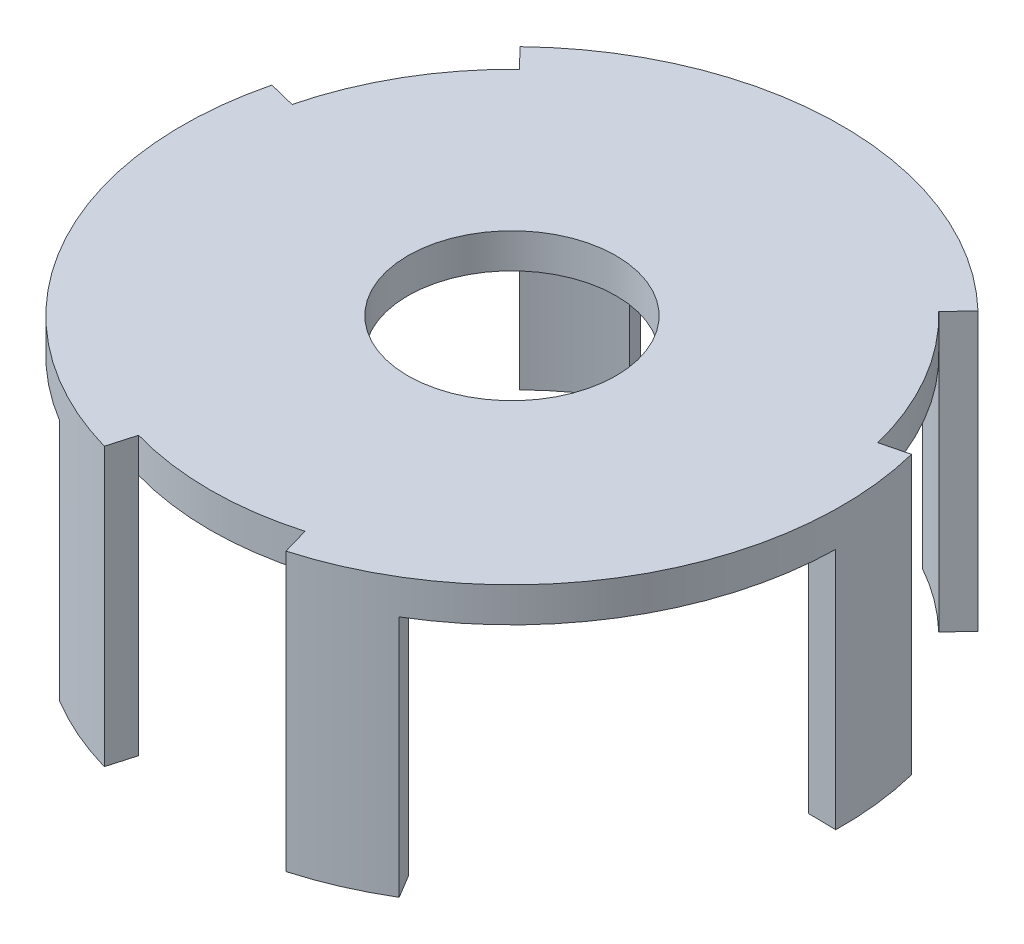
from build123d import *

# Parameters (mm, degrees)
CROQUIS2_R              = 47.5
CROQUIS2_R_2            = 15
SALIENTE_EXTRUIR1_DEPTH = 5
CORTAR_EXTRUIR1_START   = -5
CORTAR_EXTRUIR1_DEPTH   = 5
SALIENTE_EXTRUIR2_DEPTH = 35


with BuildPart() as part:
    # Croquis2 → Saliente-Extruir1 (new body)
    with BuildSketch(Plane(origin=(0, 40, 0), x_dir=(1, 0, 0), z_dir=(0, 1, 0))):
        with Locations(Location((0, 0, 0), (0, 0, 270))):
            Circle(CROQUIS2_R)
        with Locations(Location((0, 0, 0), (0, 0, 270))):
            Circle(CROQUIS2_R_2, mode=Mode.SUBTRACT)
    extrude(amount=-SALIENTE_EXTRUIR1_DEPTH)

    # Croquis3 → Cortar-Extruir1 (cut)
    with BuildSketch(Plane.XZ.offset(-35).offset(CORTAR_EXTRUIR1_START)):
        with BuildLine():
            Line((-11.990224978, 41.814883773), (-13.092774401, 45.659930557))
            ThreePointArc((-13.092774401, 45.659930557), (0, 47.5), (13.092774401, 45.659930557))
            Line((13.092774401, 45.659930557), (11.990224978, 41.814883773))
            ThreePointArc((11.990224978, 41.814883773), (0, 43.5), (-11.990224978, 41.814883773))
        make_face()
        with BuildLine():
            Line((30.217639115, -31.291281315), (32.996272597, -34.168640516))
            ThreePointArc((32.996272597, -34.168640516), (41.13620668, -23.75), (46.089046998, -11.491290041))
            Line((46.089046998, -11.491290041), (42.207864093, -10.523602459))
            ThreePointArc((42.207864093, -10.523602459), (37.672105065, -21.75), (30.217639115, -31.291281315))
        make_face()
        with BuildLine():
            Line((-42.207864093, -10.523602459), (-46.089046998, -11.491290041))
            ThreePointArc((-46.089046998, -11.491290041), (-41.13620668, -23.75), (-32.996272597, -34.168640516))
            Line((-32.996272597, -34.168640516), (-30.217639115, -31.291281315))
            ThreePointArc((-30.217639115, -31.291281315), (-37.672105065, -21.75), (-42.207864093, -10.523602459))
        make_face()
    extrude(amount=CORTAR_EXTRUIR1_DEPTH, mode=Mode.SUBTRACT)

    # Croquis4 → Saliente-Extruir2 (add)
    with BuildSketch(Plane.XZ.offset(-35)):
        with BuildLine():
            Line((-43.493374739, 0.75917968), (-47.49276552, 0.828989306))
            ThreePointArc((-47.49276552, 0.828989306), (-47.194663145, -5.377152654), (-46.089046998, -11.491290041))
            Line((-46.089046998, -11.491290041), (-42.207864093, -10.523602459))
            ThreePointArc((-42.207864093, -10.523602459), (-43.220375722, -4.924339799), (-43.493374739, 0.75917968))
        make_face()
        with BuildLine():
            Line((-22.404156259, 37.286777581), (-24.464308558, 40.715446783))
            ThreePointArc((-24.464308558, 40.715446783), (-18.940580774, 43.560353533), (-13.092774401, 45.659930557))
            Line((-13.092774401, 45.659930557), (-11.990224978, 41.814883773))
            ThreePointArc((-11.990224978, 41.814883773), (-17.345584498, 39.892113236), (-22.404156259, 37.286777581))
        make_face()
        with BuildLine():
            Line((43.493374739, 0.75917968), (47.49276552, 0.828989306))
            ThreePointArc((47.49276552, 0.828989306), (47.194663145, -5.377152654), (46.089046998, -11.491290041))
            Line((46.089046998, -11.491290041), (42.207864093, -10.523602459))
            ThreePointArc((42.207864093, -10.523602459), (43.220375722, -4.924339799), (43.493374739, 0.75917968))
        make_face()
        with BuildLine():
            Line((22.404156259, 37.286777581), (24.464308558, 40.715446783))
            ThreePointArc((24.464308558, 40.715446783), (18.940580774, 43.560353533), (13.092774401, 45.659930557))
            Line((13.092774401, 45.659930557), (11.990224978, 41.814883773))
            ThreePointArc((11.990224978, 41.814883773), (17.345584498, 39.892113236), (22.404156259, 37.286777581))
        make_face()
        with BuildLine():
            Line((-21.089218481, -38.045957261), (-23.028456962, -41.544436089))
            ThreePointArc((-23.028456962, -41.544436089), (-28.254082371, -38.183200879), (-32.996272597, -34.168640516))
            Line((-32.996272597, -34.168640516), (-30.217639115, -31.291281315))
            ThreePointArc((-30.217639115, -31.291281315), (-25.874791224, -34.967773437), (-21.089218481, -38.045957261))
        make_face()
        with BuildLine():
            Line((21.089218481, -38.045957261), (23.028456962, -41.544436089))
            ThreePointArc((23.028456962, -41.544436089), (28.254082371, -38.183200879), (32.996272597, -34.168640516))
            Line((32.996272597, -34.168640516), (30.217639115, -31.291281315))
            ThreePointArc((30.217639115, -31.291281315), (25.874791224, -34.967773437), (21.089218481, -38.045957261))
        make_face()
    extrude(amount=SALIENTE_EXTRUIR2_DEPTH)


solid = part.part
